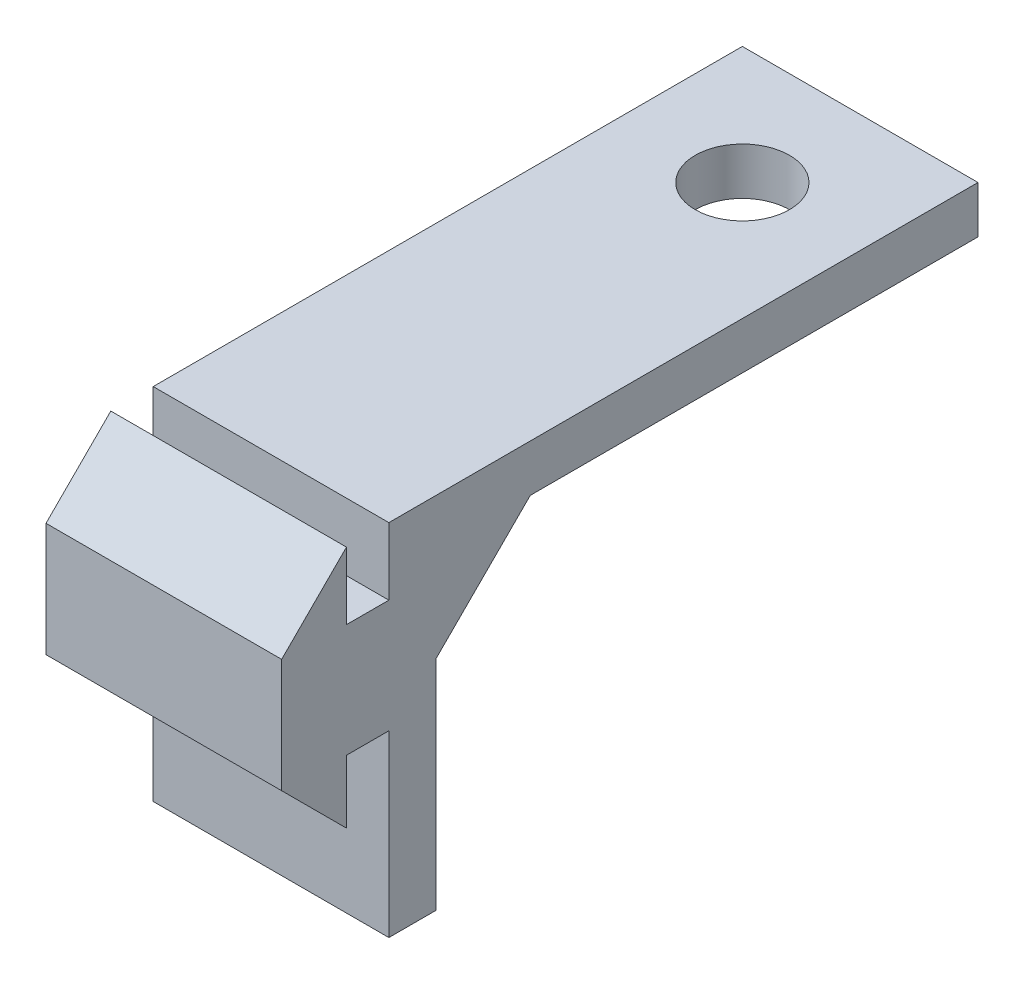
from build123d import *

# Parameters (mm, degrees)
BOSS_EXTRUDE2_DEPTH = 10
SKETCH2_R           = 2
CUT_EXTRUDE9_DEPTH  = 3


with BuildPart() as part:
    # Sketch1 → Boss-Extrude2 (new body)
    with BuildSketch(Plane(origin=(0, 0, 0), x_dir=(0, 0, -1), z_dir=(1, 0, 0))):
        Polygon((0, 0), (0, 7.6), (-1.8, 7.6), (-1.8, 4.921680622), (-4.55, 7.671680622), (-4.55, 12.5), (-1.8, 15.25), (-1.8, 12.4), (0, 12.4), (0, 15.25), (25, 15.25), (25, 13.25), (6, 13.25), (2, 9.25), (2, 0), align=None)
    extrude(amount=BOSS_EXTRUDE2_DEPTH)

    # Sketch2 → Cut-Extrude9 (cut)
    with BuildSketch(Plane(origin=(0, 15.25, 0), x_dir=(1, 0, 0), z_dir=(0, 1, 0))):
        with Locations(Location((5, 20, 0), (0, 0, 270))):
            Circle(SKETCH2_R)
    extrude(amount=-CUT_EXTRUDE9_DEPTH, mode=Mode.SUBTRACT)


solid = part.part
